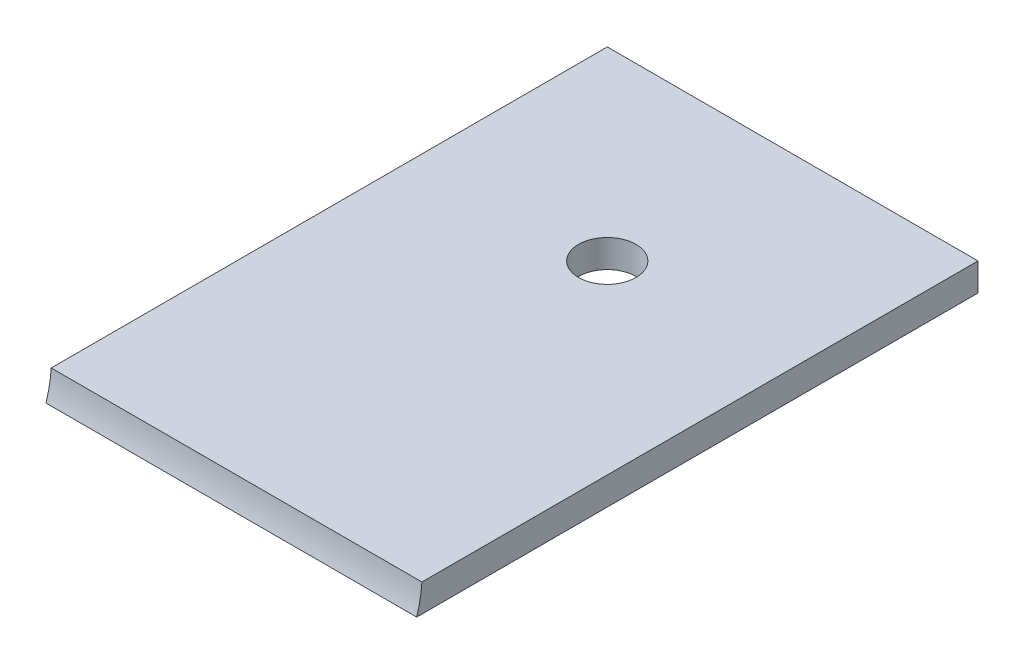
from build123d import *

# Parameters (mm, degrees)
SKETCH1_W           = 40
SKETCH1_H           = 60
SKETCH1_R           = 3.1
BOSS_EXTRUDE1_DEPTH = 3
BOSS_EXTRUDE2_DEPTH = 40


with BuildPart() as part:
    # Sketch1 → Boss-Extrude1 (new body)
    with BuildSketch(Plane(origin=(0, 0, 0), x_dir=(1, 0, 0), z_dir=(0, 1, 0))):
        Rectangle(SKETCH1_W, SKETCH1_H)
        with Locations(Location((0, 10, 0), (0, 0, 270))):
            Circle(SKETCH1_R, mode=Mode.SUBTRACT)
    extrude(amount=BOSS_EXTRUDE1_DEPTH)

    # Sketch3 → Boss-Extrude2 (add)
    with BuildSketch(Plane(origin=(20, 0, 0), x_dir=(0, 0, -1), z_dir=(1, 0, 0))):
        with BuildLine():
            Line((-30, 0), (-30.562875043, 0))
            ThreePointArc((-30.562875043, 0), (-30.190981376, 1.483028164), (-30, 3))
            Line((-30, 3), (-30, 0))
        make_face()
    extrude(amount=-BOSS_EXTRUDE2_DEPTH)


solid = part.part
